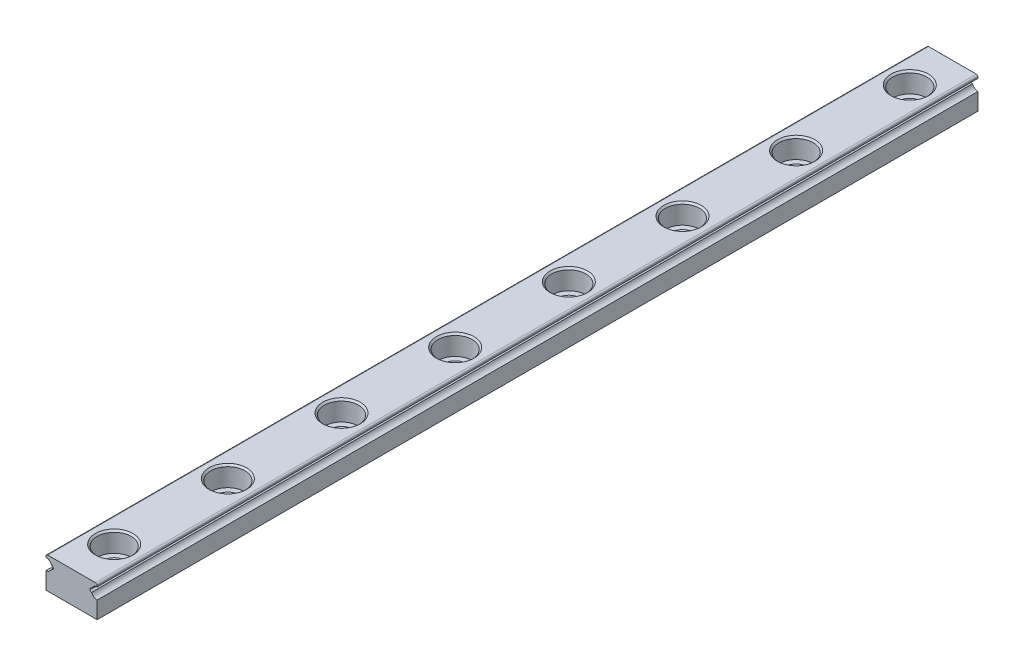
from build123d import *

# Parameters (mm, degrees)
BOSS_EXTRUDE1_DEPTH        = 155
FILLET1_R                  = 0.3
CUT_EXTRUDE1_DEPTH         = 155
CUT_EXTRUDE2_DEPTH         = 3.5
CHAMFER1_SIZE              = 0.3
LPATTERN1_COUNT            = 8
LPATTERN1_PITCH            = 20
CHAMFER1_OF_LPATTERN1_SIZE = 0.3


with BuildPart() as part:
    # Sketch1 → Boss-Extrude1 (new body)
    with BuildSketch(Plane.XY):
        with BuildLine():
            Line((4.5, 2.75), (-4.5, 2.75))
            Line((-4.5, 2.75), (-4.5, 2.25))
            ThreePointArc((-4.5, 2.25), (-3.906959444, 2.05517259), (-3.545, 1.546605799))
            ThreePointArc((-3.545, 1.546605799), (-3.304423928, 1.477486263), (-3.2, 1.25))
            ThreePointArc((-3.2, 1.25), (-3.304423928, 1.022513737), (-3.545, 0.953394201))
            ThreePointArc((-3.545, 0.953394201), (-3.906959444, 0.44482741), (-4.5, 0.25))
            Line((-4.5, 0.25), (-4.5, -2.75))
            Line((-4.5, -2.75), (4.5, -2.75))
            Line((4.5, -2.75), (4.5, 0.25))
            ThreePointArc((4.5, 0.25), (3.906959444, 0.44482741), (3.545, 0.953394201))
            ThreePointArc((3.545, 0.953394201), (3.2, 1.25), (3.545, 1.546605799))
            ThreePointArc((3.545, 1.546605799), (3.906959444, 2.05517259), (4.5, 2.25))
            Line((4.5, 2.25), (4.5, 2.75))
        make_face()
    extrude(amount=BOSS_EXTRUDE1_DEPTH)

    # Fillet1
    fillet1_edges = [part.edges().sort_by_distance(p)[0] for p in [
        (4.5, 2.75, 77.5),
        (-4.5, 2.75, 77.5),
    ]]
    fillet(fillet1_edges, radius=FILLET1_R)

    # Sketch2 → Cut-Extrude1 (cut)
    with BuildSketch(Plane(origin=(0, 2.75, 0), x_dir=(1, 0, 0), z_dir=(0, 1, 0))):
        with BuildLine():
            ThreePointArc((1.75, -7.5), (1.237436867, -6.262563133), (0, -5.75))
            ThreePointArc((0, -5.75), (-1.237436867, -8.737436867), (1.75, -7.5))
        make_face()
    cut_extrude1 = extrude(amount=-CUT_EXTRUDE1_DEPTH, mode=Mode.SUBTRACT)

    # Sketch2<3> → Cut-Extrude2 (cut)
    with BuildSketch(Plane(origin=(0, 2.75, 0), x_dir=(1, 0, 0), z_dir=(0, 1, 0))):
        with BuildLine():
            ThreePointArc((3, -7.5), (2.121320344, -5.378679656), (0, -4.5))
            ThreePointArc((0, -4.5), (-2.121320344, -9.621320344), (3, -7.5))
        make_face()
        with BuildLine():
            ThreePointArc((1.75, -7.5), (-1.237436867, -8.737436867), (0, -5.75))
            ThreePointArc((0, -5.75), (1.237436867, -6.262563133), (1.75, -7.5))
        make_face(mode=Mode.SUBTRACT)
    cut_extrude2 = extrude(amount=-CUT_EXTRUDE2_DEPTH, mode=Mode.SUBTRACT)

    # Chamfer1
    chamfer1_edges = [part.edges().sort_by_distance(p)[0] for p in [
        (-1.75, -0.75, 7.5),
        (-3, 2.75, 7.5),
    ]]
    chamfer(chamfer1_edges, length=CHAMFER1_SIZE)

    # LPattern1: Cut-Extrude1, Cut-Extrude2 ×8
    with Locations(*[(0, 0, i * LPATTERN1_PITCH) for i in range(1, LPATTERN1_COUNT)]):
        add(cut_extrude1, mode=Mode.SUBTRACT)
        add(cut_extrude2, mode=Mode.SUBTRACT)

    # Chamfer1 of LPattern1
    chamfer1_of_lpattern1_edges = [part.edges().sort_by_distance(p)[0] for p in [
        (-1.75, -0.75, 27.5),
        (-3, 2.75, 27.5),
        (-1.75, -0.75, 47.5),
        (-3, 2.75, 47.5),
        (-1.75, -0.75, 67.5),
        (-3, 2.75, 67.5),
        (-1.75, -0.75, 87.5),
        (-3, 2.75, 87.5),
        (-1.75, -0.75, 107.5),
        (-3, 2.75, 107.5),
        (-1.75, -0.75, 127.5),
        (-3, 2.75, 127.5),
        (-1.75, -0.75, 147.5),
        (-3, 2.75, 147.5),
    ]]
    chamfer(chamfer1_of_lpattern1_edges, length=CHAMFER1_OF_LPATTERN1_SIZE)


solid = part.part
